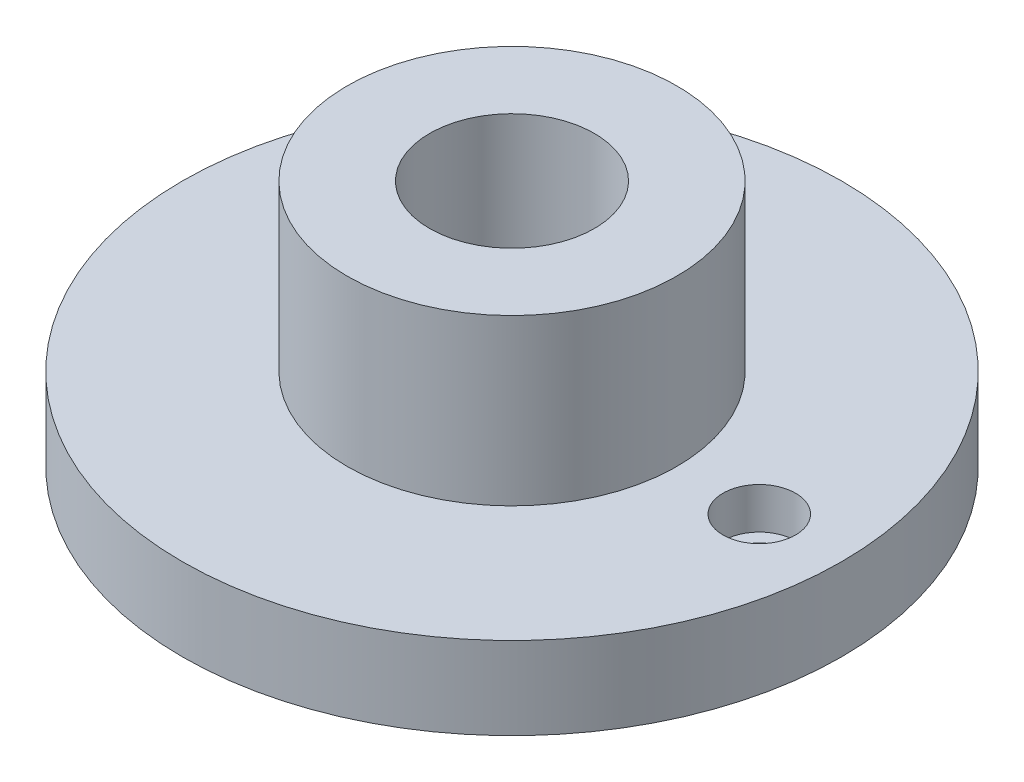
from build123d import *

# Parameters (mm, degrees)
SKETCH2_R                                        = 50.8
FLANGE_DEPTH                                     = 12.7
SKETCH3_R                                        = 25.4
HUB_DEPTH                                        = 25.4
SKETCH4_R                                        = 12.7
BORE_DEPTH                                       = 82.319677815
CBORE_FOR_1_4_SOCKET_HEAD_CAP_SCREW2_D           = 7.112
CBORE_FOR_1_4_SOCKET_HEAD_CAP_SCREW2_CBORE_D     = 11.176
CBORE_FOR_1_4_SOCKET_HEAD_CAP_SCREW2_CBORE_DEPTH = 6.35


with BuildPart() as part:
    # Sketch2 → Flange (new body)
    with BuildSketch(Plane(origin=(0, 0, 0), x_dir=(1, 0, 0), z_dir=(0, 1, 0))):
        with Locations(Location((0, 0, 0), (0, 0, 270))):
            Circle(SKETCH2_R)
    extrude(amount=FLANGE_DEPTH)

    # Sketch3 → Hub (add)
    with BuildSketch(Plane(origin=(0, 12.7, 0), x_dir=(1, 0, 0), z_dir=(0, 1, 0))):
        with Locations(Location((0, 0, 0), (0, 0, 270))):
            Circle(SKETCH3_R)
    extrude(amount=HUB_DEPTH)

    # Sketch4 → Bore (cut, through all)
    with BuildSketch(Plane(origin=(0, 38.1, 0), x_dir=(1, 0, 0), z_dir=(0, 1, 0))):
        with Locations(Location((0, 0, 0), (0, 0, 270))):
            Circle(SKETCH4_R)
    extrude(amount=-BORE_DEPTH, mode=Mode.SUBTRACT)

    # CBORE for 1/4 Socket Head Cap Screw2 (through all)
    with Locations(Plane(origin=(0, 12.7, 0), x_dir=(1, 0, 0), z_dir=(0, 1, 0))):
        with Locations((38.1, 0)):
            CounterBoreHole(CBORE_FOR_1_4_SOCKET_HEAD_CAP_SCREW2_D / 2, CBORE_FOR_1_4_SOCKET_HEAD_CAP_SCREW2_CBORE_D / 2, CBORE_FOR_1_4_SOCKET_HEAD_CAP_SCREW2_CBORE_DEPTH)


solid = part.part
